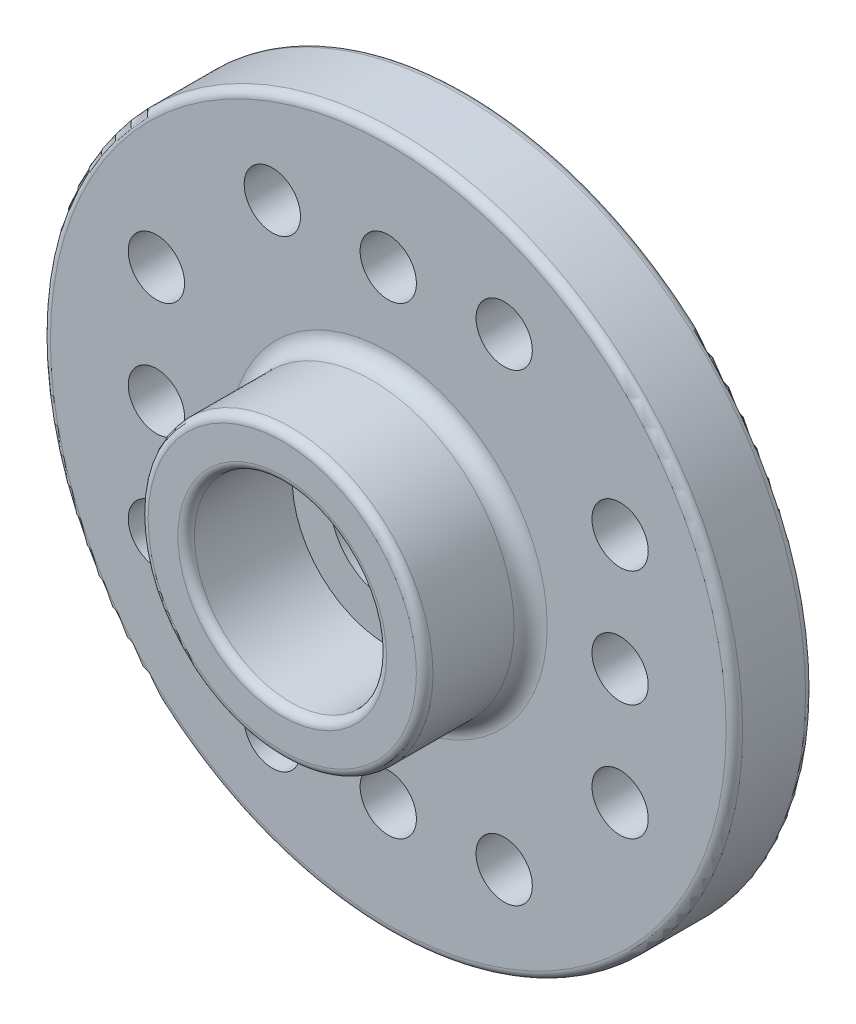
from build123d import *

# Parameters (mm, degrees)
SKETCH1_R           = 10.45
SKETCH1_R_2         = 1.75
BOSS_EXTRUDE1_DEPTH = 2.4
SKETCH2_R           = 4.3
SKETCH2_R_2         = 2.9
BOSS_EXTRUDE2_DEPTH = 3.2
SKETCH4_R           = 3.6
SKETCH4_R_2         = 3.3
BOSS_EXTRUDE3_DEPTH = 0.2
CUT_EXTRUDE2_START  = -0.4
SKETCH5_R           = 4
SKETCH5_R_2         = 3.6
SKETCH5_R_3         = 3.3
CUT_EXTRUDE2_DEPTH  = 0.4
SKETCH6_R           = 0.85
CUT_EXTRUDE3_DEPTH  = 16.803955201
CIRPATTERN1_COUNT   = 4
FILLET1_R           = 0.25
FILLET2_R           = 0.5


with BuildPart() as part:
    # Sketch1 → Boss-Extrude1 (new body)
    with BuildSketch(Plane.XY):
        Circle(SKETCH1_R)
        Circle(SKETCH1_R_2, mode=Mode.SUBTRACT)
    extrude(amount=BOSS_EXTRUDE1_DEPTH)

    # Sketch2 → Boss-Extrude2 (add)
    with BuildSketch(Plane.XY.offset(2.4)):
        Circle(SKETCH2_R)
        Circle(SKETCH2_R_2, mode=Mode.SUBTRACT)
    extrude(amount=BOSS_EXTRUDE2_DEPTH)

    # Sketch4 → Boss-Extrude3 (add)
    with BuildSketch(Plane(origin=(0, 0, 0), x_dir=(-1, 0, 0), z_dir=(0, 0, -1))):
        with Locations(Location((0, 0, 0), (0, 0, 180))):
            Circle(SKETCH4_R)
        Circle(SKETCH4_R_2, mode=Mode.SUBTRACT)
    extrude(amount=BOSS_EXTRUDE3_DEPTH)

    # Sketch5 → Cut-Extrude2 (cut)
    # profile 1 of 2: a face of its own
    with BuildSketch(Plane(origin=(0, 0, 0), x_dir=(-1, 0, 0), z_dir=(0, 0, -1)).offset(CUT_EXTRUDE2_START)):
        Circle(SKETCH5_R)
        Circle(SKETCH5_R_2, mode=Mode.SUBTRACT)
    # profile 2 of 2: a face of its own
    with BuildSketch(Plane(origin=(0, 0, 0), x_dir=(-1, 0, 0), z_dir=(0, 0, -1)).offset(CUT_EXTRUDE2_START)):
        Circle(SKETCH5_R_3)
    extrude(amount=CUT_EXTRUDE2_DEPTH, mode=Mode.SUBTRACT)

    # Sketch6 → Cut-Extrude3 (cut, through all)
    with BuildSketch(Plane(origin=(0, 0, 0), x_dir=(-1, 0, 0), z_dir=(0, 0, -1))):
        with Locations((0, 7)):
            Circle(SKETCH6_R)
        with Locations((3.5, 7)):
            Circle(SKETCH6_R)
        with Locations((-3.5, 7)):
            Circle(SKETCH6_R)
    cut_extrude3 = extrude(amount=-CUT_EXTRUDE3_DEPTH, mode=Mode.SUBTRACT)

    # CirPattern1: Cut-Extrude3 ×4 about axis
    cirpattern1_axis = Axis((0, 0, 0), (0, 0, 1))
    for i in range(1, CIRPATTERN1_COUNT):
        add(cut_extrude3.rotate(cirpattern1_axis, i * 360 / CIRPATTERN1_COUNT), mode=Mode.SUBTRACT)

    # Fillet1
    fillet1_edges = [part.edges().sort_by_distance(p)[0] for p in [
        (-4.3, 0, 5.6),
        (-2.9, 0, 5.6),
        (-10.45, 0, 0),
        (-10.45, 0, 2.4),
    ]]
    fillet(fillet1_edges, radius=FILLET1_R)

    # Fillet2
    fillet2_edges = [part.edges().sort_by_distance(p)[0] for p in [
        (-4.3, 0, 2.4),
    ]]
    fillet(fillet2_edges, radius=FILLET2_R)


solid = part.part
